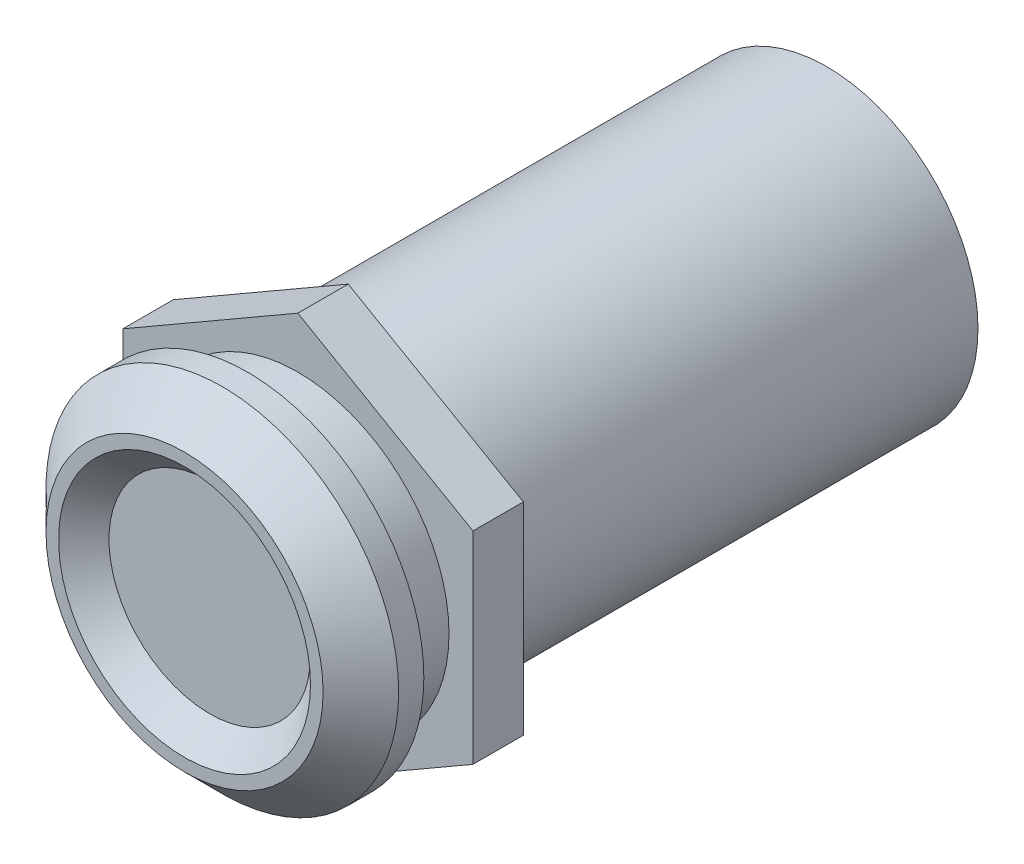
from build123d import *

# Parameters (mm, degrees)
SKETCH1_R           = 7
BOSS_EXTRUDE1_DEPTH = 1
SKETCH2_R           = 7
BOSS_EXTRUDE2_DEPTH = 1.5
BOSS_EXTRUDE2_TAPER = 45
SKETCH3_R           = 5
CUT_EXTRUDE1_DEPTH  = 1
CUT_EXTRUDE1_DRAFT  = -45
SKETCH4_R           = 6
BOSS_EXTRUDE3_DEPTH = 23
NUT_DEPTH           = 2


with BuildPart() as part:
    # Sketch1 → Boss-Extrude1 (new body)
    with BuildSketch(Plane.XY):
        Circle(SKETCH1_R)
    extrude(amount=BOSS_EXTRUDE1_DEPTH)

    # Sketch2 → Boss-Extrude2 (add)
    with BuildSketch(Plane.XY.offset(1)):
        Circle(SKETCH2_R)
    extrude(amount=BOSS_EXTRUDE2_DEPTH, taper=BOSS_EXTRUDE2_TAPER)


with BuildPart() as cut_extrude1_tool:
    # Sketch3 → Cut-Extrude1 (with draft: the straight prism first)
    with BuildSketch(Plane.XY.offset(2.5)):
        Circle(SKETCH3_R)
    extrude(amount=-CUT_EXTRUDE1_DEPTH)
    # Cut-Extrude1: the draft: its side faces are tilted about the plane it starts from
    cut_extrude1_sides = [cut_extrude1_tool.faces().sort_by_distance(p)[0] for p in [
        (-5, 0, 2),
    ]]
    draft(cut_extrude1_sides, Plane.XY.offset(2.5), CUT_EXTRUDE1_DRAFT)


with BuildPart() as part_1:
    add(part.part)

    # Cut-Extrude1: cut by cut_extrude1_tool
    add(cut_extrude1_tool.part, mode=Mode.SUBTRACT)

    # Sketch4 → Boss-Extrude3 (add)
    with BuildSketch(Plane.XY):
        Circle(SKETCH4_R)
    extrude(amount=-BOSS_EXTRUDE3_DEPTH)

    # Sketch5 → Nut (add)
    with BuildSketch(Plane.XY.offset(-2)):
        Polygon((0, 8.025168742), (-6.95, 4.012584371), (-6.95, -4.012584371), (0, -8.025168742), (6.95, -4.012584371), (6.95, 4.012584371), align=None)
    extrude(amount=-NUT_DEPTH)


solid = part_1.part
